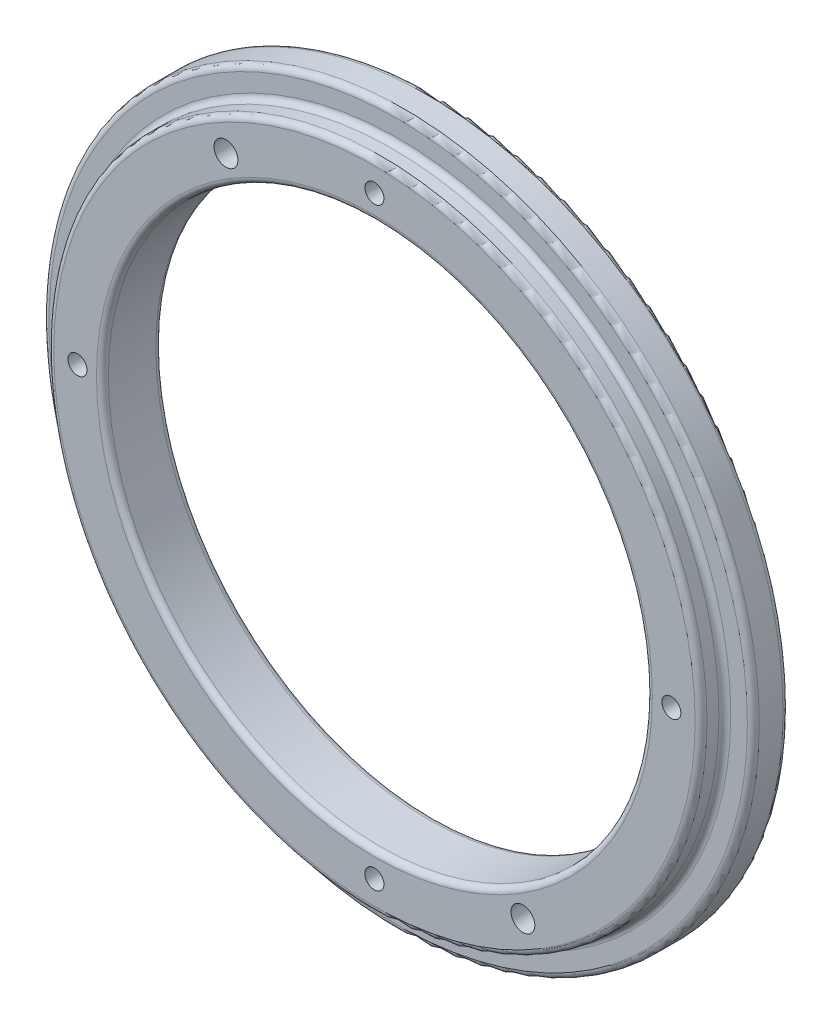
from build123d import *

# Parameters (mm, degrees)
SKETCH1_R           = 75.946
SKETCH1_R_2         = 58.166
BOSS_EXTRUDE1_DEPTH = 7.62
SKETCH2_R           = 69.85
SKETCH2_R_2         = 58.166
BOSS_EXTRUDE2_DEPTH = 5.08
SKETCH4_R           = 2.032
CUT_EXTRUDE1_DEPTH  = 109.152114321
FILLET1_R           = 1.27
SKETCH5_R           = 2.5527
CUT_EXTRUDE2_DEPTH  = 109.152114391


with BuildPart() as part:
    # Sketch1 → Boss-Extrude1 (new body)
    with BuildSketch(Plane.XY):
        with Locations(Location((0, 0, 0), (0, 0, 180))):
            Circle(SKETCH1_R)
        with Locations(Location((0, 0, 0), (0, 0, 180))):
            Circle(SKETCH1_R_2, mode=Mode.SUBTRACT)
    extrude(amount=BOSS_EXTRUDE1_DEPTH)

    # Sketch2 → Boss-Extrude2 (add)
    with BuildSketch(Plane.XY.offset(7.62)):
        Circle(SKETCH2_R)
        with Locations(Location((0, 0, 0), (0, 0, 180))):
            Circle(SKETCH2_R_2, mode=Mode.SUBTRACT)
    extrude(amount=BOSS_EXTRUDE2_DEPTH)

    # Sketch4 → Cut-Extrude1 (cut, through all)
    with BuildSketch(Plane(origin=(0, 0, 0), x_dir=(-1, 0, 0), z_dir=(0, 0, -1))):
        with Locations((0, 63.5)):
            Circle(SKETCH4_R)
        with Locations((63.5, 0)):
            Circle(SKETCH4_R)
        with Locations((0, -63.5)):
            Circle(SKETCH4_R)
        with Locations((-63.5, 0)):
            Circle(SKETCH4_R)
    extrude(amount=-CUT_EXTRUDE1_DEPTH, mode=Mode.SUBTRACT)

    # Fillet1
    fillet1_edges = [part.edges().sort_by_distance(p)[0] for p in [
        (-69.85, 0, 7.62),
        (-69.85, 0, 12.7),
        (58.166, 0, 12.7),
        (75.946, 0, 0),
        (75.946, 0, 7.62),
        (58.166, 0, 0),
    ]]
    fillet(fillet1_edges, radius=FILLET1_R)

    # Sketch5 → Cut-Extrude2 (cut, through all)
    with BuildSketch(Plane(origin=(0, 0, 0), x_dir=(-1, 0, 0), z_dir=(0, 0, -1))):
        with Locations((-31.75, -54.99261314)):
            Circle(SKETCH5_R)
        with Locations((31.75, 54.99261314)):
            Circle(SKETCH5_R)
    extrude(amount=-CUT_EXTRUDE2_DEPTH, mode=Mode.SUBTRACT)


solid = part.part
